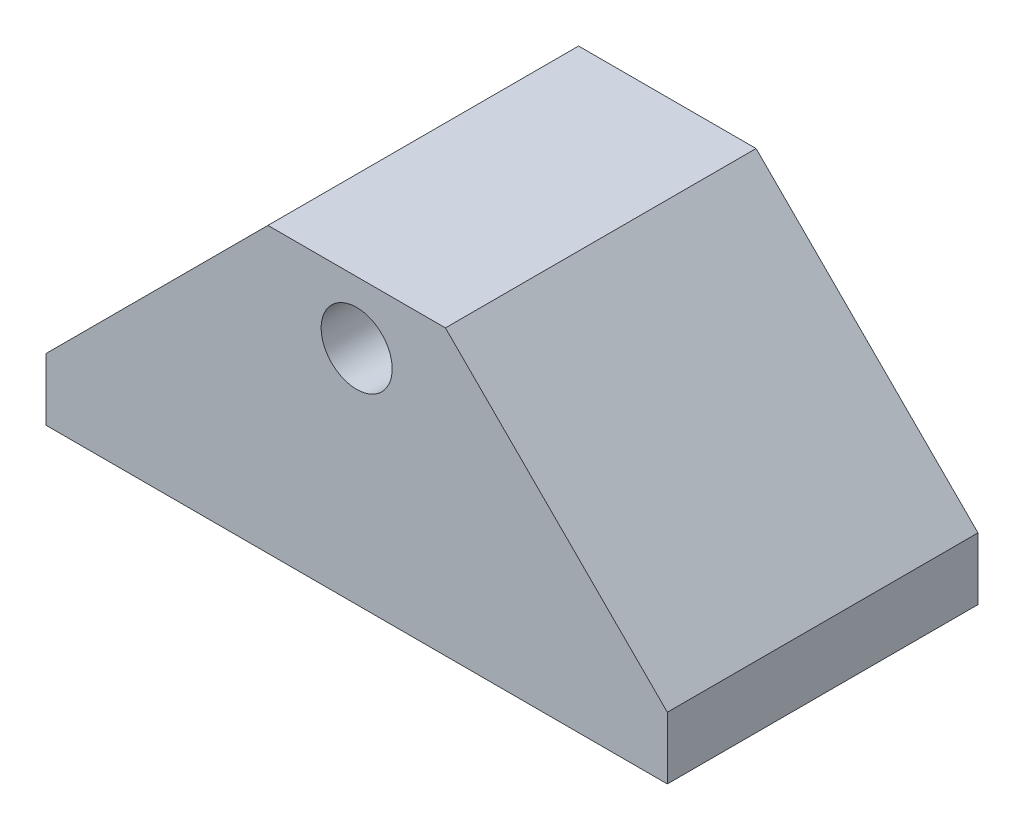
from build123d import *

# Parameters (mm, degrees)
SKETCH1_W           = 70
SKETCH1_H           = 35
BOSS_EXTRUDE1_DEPTH = 32
SKETCH2_R           = 4
CUT_EXTRUDE1_DEPTH  = 59.940648113
CHAMFER1_SIZE       = 25


with BuildPart() as part:
    # Sketch1 → Boss-Extrude1 (new body)
    with BuildSketch(Plane(origin=(0, 0, 0), x_dir=(1, 0, 0), z_dir=(0, 1, 0))):
        Rectangle(SKETCH1_W, SKETCH1_H)
    extrude(amount=BOSS_EXTRUDE1_DEPTH)

    # Sketch2 → Cut-Extrude1 (cut, through all)
    with BuildSketch(Plane.XY.offset(17.5)):
        with Locations((0, 25)):
            Circle(SKETCH2_R)
    extrude(amount=-CUT_EXTRUDE1_DEPTH, mode=Mode.SUBTRACT)

    # Chamfer1
    chamfer1_edges = [part.edges().sort_by_distance(p)[0] for p in [
        (-35, 32, 0),
        (35, 32, 0),
    ]]
    chamfer(chamfer1_edges, length=CHAMFER1_SIZE)


solid = part.part
